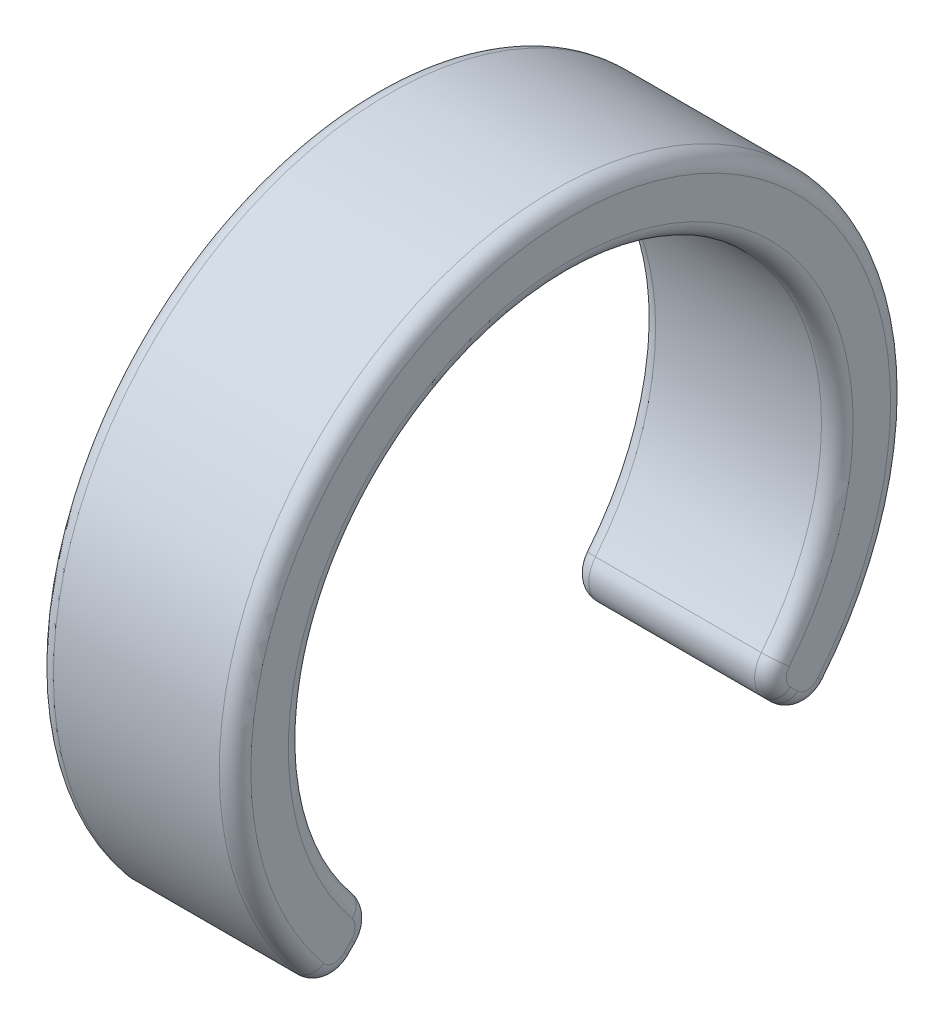
from build123d import *

# Parameters (mm, degrees)
SKIZZE1_W       = 10
SKIZZE1_H       = 3.5
ROTATION1_ANGLE = 270
VERRUNDUNG1_R   = 1.5
VERRUNDUNG2_R   = 0.8


with BuildPart() as part:
    # Skizze1 → Rotation1 (revolve, symmetric)
    with BuildSketch(Plane.XY) as rotation1_sk:
        with Locations((0, 15.25)):
            Rectangle(SKIZZE1_W, SKIZZE1_H)
    revolve(axis=Axis((-29.230918038, 0, 0), (1, 0, 0)), revolution_arc=ROTATION1_ANGLE / 2)
    revolve(rotation1_sk.sketch, axis=Axis((-29.230918038, 0, 0), (-1, 0, 0)), revolution_arc=ROTATION1_ANGLE / 2)

    # Verrundung1
    verrundung1_edges = [part.edges().sort_by_distance(p)[0] for p in [
        (0, -12.02081528, -12.02081528),
        (0, -9.545941546, -9.545941546),
        (0, -9.545941546, 9.545941546),
        (0, -12.02081528, 12.02081528),
    ]]
    fillet(verrundung1_edges, radius=VERRUNDUNG1_R)

    # Verrundung2
    verrundung2_edges = [part.edges().sort_by_distance(p)[0] for p in [
        (5, -11.346290795, 12.042038249),
        (5, -10.731073787, 10.731073787),
        (5, -9.56786945, 10.115976522),
        (5, 13.5, 0),
        (5, -9.56786945, -10.115976522),
        (5, -10.731073787, -10.731073787),
        (5, -11.346290795, -12.042038249),
        (-5, -9.56786945, 10.115976522),
        (-5, -10.731073787, 10.731073787),
        (-5, -11.346290795, 12.042038249),
        (-5, 17, 0),
        (-5, -11.346290795, -12.042038249),
        (-5, -10.731073787, -10.731073787),
        (-5, -9.56786945, -10.115976522),
        (5, 17, 0),
        (-5, 13.5, 0),
    ]]
    fillet(verrundung2_edges, radius=VERRUNDUNG2_R)


solid = part.part
